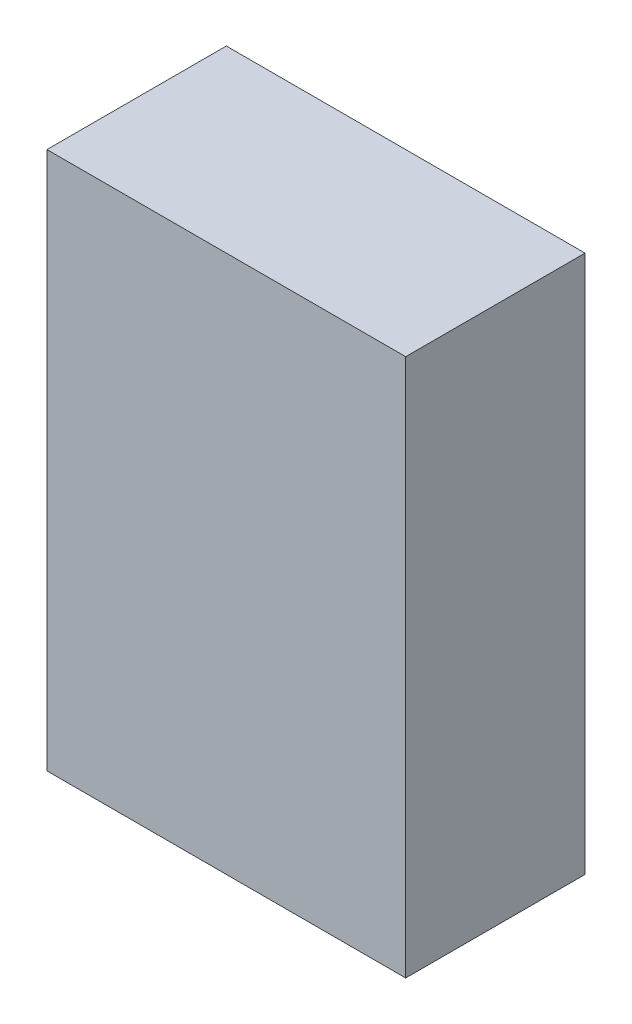
from build123d import *

# Parameters (mm, degrees)
SKETCH1_W           = 20
SKETCH1_H           = 30
BOSS_EXTRUDE1_DEPTH = 10


with BuildPart() as part:
    # Sketch1 → Boss-Extrude1 (new body)
    with BuildSketch(Plane.XY):
        with Locations((-4.633298575, -0.98540146)):
            Rectangle(SKETCH1_W, SKETCH1_H)
    extrude(amount=BOSS_EXTRUDE1_DEPTH)


solid = part.part
